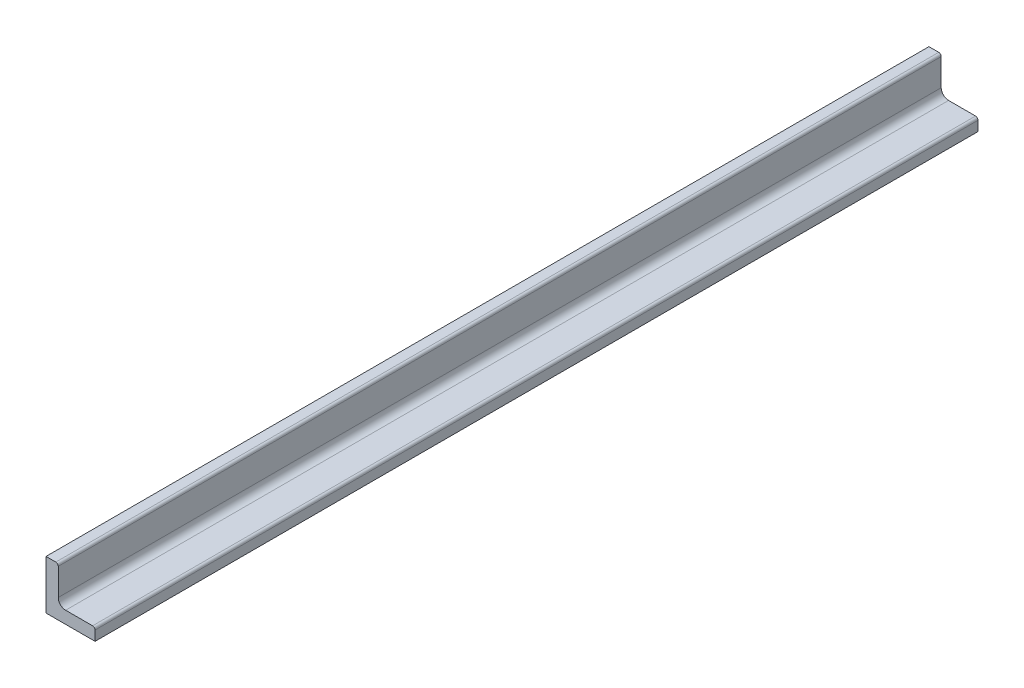
from build123d import *

# Parameters (mm, degrees)
BOSS_EXTRUDE1_DEPTH = 228.6


with BuildPart() as part:
    # Sketch3 → Boss-Extrude1 (new body)
    with BuildSketch(Plane.XY):
        with BuildLine():
            Line((0, 1.905), (0, 8.89))
            ThreePointArc((0, 8.89), (-0.185987194, 9.339012806), (-0.635, 9.525))
            Line((-0.635, 9.525), (-3.175, 9.525))
            Line((-3.175, 9.525), (-3.175, -3.048))
            ThreePointArc((-3.175, -3.048), (-3.137802561, -3.137802561), (-3.048, -3.175))
            Line((-3.048, -3.175), (9.525, -3.175))
            Line((9.525, -3.175), (9.525, -0.635))
            ThreePointArc((9.525, -0.635), (9.339012806, -0.185987194), (8.89, 0))
            Line((8.89, 0), (1.905, 0))
            ThreePointArc((1.905, 0), (0.557961582, 0.557961582), (0, 1.905))
        make_face()
    extrude(amount=BOSS_EXTRUDE1_DEPTH)


solid = part.part
